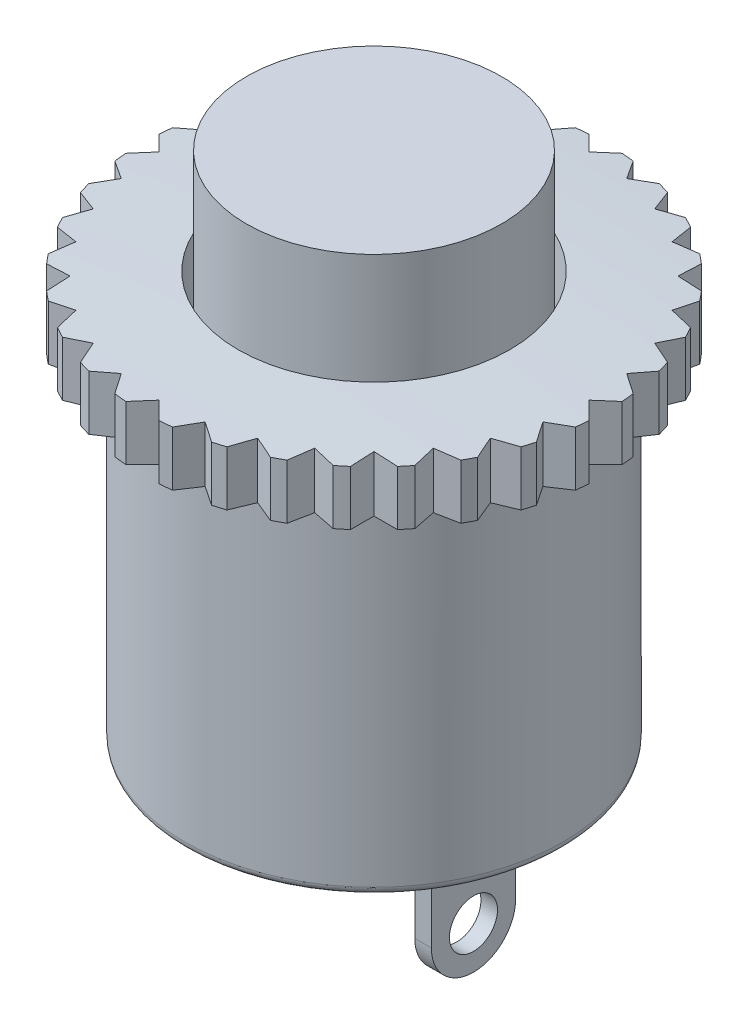
from build123d import *

# Parameters (mm, degrees)
CUT_EXTRUDE1_START  = 3
SKETCH2_R           = 4.1
SKETCH2_R_2         = 3.85
CUT_EXTRUDE1_DEPTH  = 3
CUT_EXTRUDE2_REACH  = 17.805
CIRPATTERN1_COUNT   = 32
SKETCH4_R           = 5.2
CUT_EXTRUDE3_DEPTH  = 0.5
FILLET1_R           = 0.25
SKETCH5_W           = 0.5
SKETCH5_H           = 2.54
BOSS_EXTRUDE1_DEPTH = 5
CUT_EXTRUDE4_REACH  = 25.393


with BuildPart() as part:
    # Sketch1 → Revolve1 (revolve)
    with BuildSketch(Plane.XY, mode=Mode.PRIVATE) as revolve1_sk:
        with BuildLine():
            Line((0, 0), (-3.85, 0))
            Line((-3.85, 0), (-3.85, -3.15))
            ThreePointArc((-3.85, -3.15), (-5.425674982, -3.223158245), (-7, -3.321160879))
            Line((-7, -3.321160879), (-7, -4.971160879))
            Line((-7, -4.971160879), (-5.7, -4.971160879))
            Line((-5.7, -4.971160879), (-5.7, -15.471160879))
            Line((-5.7, -15.471160879), (0, -15.471160879))
            Line((0, -15.471160879), (0, 0))
        make_face()
    revolve(revolve1_sk.sketch.rotate(Axis((0, 8.395483871, 0), (0, -1, 0)), 270), axis=Axis((0, 8.395483871, 0), (0, -1, 0)))

    # Sketch2 → Cut-Extrude1 (cut)
    with BuildSketch(Plane(origin=(0, -3.15, 0), x_dir=(-1, 0, 0), z_dir=(0, -1, 0)).offset(CUT_EXTRUDE1_START)):
        Circle(SKETCH2_R)
        with Locations(Location((0, 0, 0), (0, 0, 270))):
            Circle(SKETCH2_R_2, mode=Mode.SUBTRACT)
    extrude(amount=-CUT_EXTRUDE1_DEPTH, mode=Mode.SUBTRACT)

    # Sketch3 → Cut-Extrude2 (cut, up to next)
    with BuildSketch(Plane(origin=(0, -3.15, 0), x_dir=(-1, 0, 0), z_dir=(0, -1, 0)), mode=Mode.PRIVATE) as cut_extrude2_sk1:
        with BuildLine():
            Line((0, 6.482120022), (0, 7))
            ThreePointArc((0, 7), (-0.250159796, 6.995528577), (-0.5, 6.982120022))
            Line((-0.5, 6.982120022), (0, 6.482120022))
        make_face()
    cut_extrude2_tool1 = extrude(cut_extrude2_sk1.sketch, amount=CUT_EXTRUDE2_REACH, mode=Mode.PRIVATE) & part.part
    # Sketch3 → Cut-Extrude2 (cut, up to next)
    with BuildSketch(Plane(origin=(0, -3.15, 0), x_dir=(-1, 0, 0), z_dir=(0, -1, 0)), mode=Mode.PRIVATE) as cut_extrude2_sk2:
        with BuildLine():
            ThreePointArc((0.5, 6.982120022), (0.250159796, 6.995528577), (0, 7))
            Line((0, 7), (0, 6.482120022))
            Line((0, 6.482120022), (0.5, 6.982120022))
        make_face()
    cut_extrude2_tool2 = extrude(cut_extrude2_sk2.sketch, amount=CUT_EXTRUDE2_REACH, mode=Mode.PRIVATE) & part.part
    cut_extrude2_1 = cut_extrude2_tool1.solids().sort_by_distance((0.167616, -3.15, -6.823366))[0]
    add(cut_extrude2_1, mode=Mode.SUBTRACT)
    cut_extrude2_2 = cut_extrude2_tool2.solids().sort_by_distance((-0.167616, -3.15, -6.823366))[0]
    add(cut_extrude2_2, mode=Mode.SUBTRACT)
    cut_extrude2 = cut_extrude2_1 + cut_extrude2_2  # Cut-Extrude2 as one shape, for the pattern or mirror that repeats it

    # CirPattern1: Cut-Extrude2 ×32 about axis
    cirpattern1_axis = Axis((0, 0, 0), (0, 1, 0))
    for i in range(1, CIRPATTERN1_COUNT):
        add(cut_extrude2.rotate(cirpattern1_axis, i * 360 / CIRPATTERN1_COUNT), mode=Mode.SUBTRACT)

    # Sketch4 → Cut-Extrude3 (cut)
    with BuildSketch(Plane.XZ.offset(15.471160879)):
        with Locations(Location((0, 0, 0), (0, 0, 270))):
            Circle(SKETCH4_R)
    extrude(amount=-CUT_EXTRUDE3_DEPTH, mode=Mode.SUBTRACT)

    # Fillet1
    fillet1_edges = [part.edges().sort_by_distance(p)[0] for p in [
        (0, -15.471160879, -5.7),
    ]]
    fillet(fillet1_edges, radius=FILLET1_R)

    # Sketch5 → Boss-Extrude1 (add)
    with BuildSketch(Plane.XZ.offset(14.971160879)):
        with Locations((-2.75, 0)):
            Rectangle(SKETCH5_W, SKETCH5_H)
        with Locations((2.75, 0)):
            Rectangle(SKETCH5_W, SKETCH5_H)
    extrude(amount=BOSS_EXTRUDE1_DEPTH)

    # Cut-Extrude4: up to this face of the body (flat: up to its plane)
    cut_extrude4_end = Plane(part.part.faces().sort_by_distance((-3, -17.471160879, 0))[0])
    # Sketch6 → Cut-Extrude4 (cut, up to the picked face)
    with BuildSketch(Plane(origin=(3, 0, 0), x_dir=(0, 0, -1), z_dir=(1, 0, 0)), mode=Mode.PRIVATE) as cut_extrude4_sk1:
        with BuildLine():
            Line((-1.27, -19.971160879), (0, -19.971160879))
            ThreePointArc((0, -19.971160879), (-0.898025612, -19.599186491), (-1.27, -18.701160879))
            Line((-1.27, -18.701160879), (-1.27, -19.971160879))
        make_face()
    cut_extrude4_tool1 = split(extrude(cut_extrude4_sk1.sketch, amount=-CUT_EXTRUDE4_REACH, mode=Mode.PRIVATE), bisect_by=cut_extrude4_end, keep=Keep.BOTH, mode=Mode.PRIVATE)
    # Sketch6 → Cut-Extrude4 (cut, up to the picked face)
    with BuildSketch(Plane(origin=(3, 0, 0), x_dir=(0, 0, -1), z_dir=(1, 0, 0)), mode=Mode.PRIVATE) as cut_extrude4_sk2:
        with BuildLine():
            ThreePointArc((1.27, -18.701160879), (0.898025612, -19.599186491), (0, -19.971160879))
            Line((0, -19.971160879), (1.27, -19.971160879))
            Line((1.27, -19.971160879), (1.27, -18.701160879))
        make_face()
    cut_extrude4_tool2 = split(extrude(cut_extrude4_sk2.sketch, amount=-CUT_EXTRUDE4_REACH, mode=Mode.PRIVATE), bisect_by=cut_extrude4_end, keep=Keep.BOTH, mode=Mode.PRIVATE)
    # Sketch6 → Cut-Extrude4 (cut, up to the picked face)
    with BuildSketch(Plane(origin=(3, 0, 0), x_dir=(0, 0, -1), z_dir=(1, 0, 0)), mode=Mode.PRIVATE) as cut_extrude4_sk3:
        with BuildLine():
            ThreePointArc((0, -17.976160879), (-0.725, -18.701160879), (0, -19.426160879))
            Line((0, -19.426160879), (0, -17.976160879))
        make_face()
    cut_extrude4_tool3 = split(extrude(cut_extrude4_sk3.sketch, amount=-CUT_EXTRUDE4_REACH, mode=Mode.PRIVATE), bisect_by=cut_extrude4_end, keep=Keep.BOTH, mode=Mode.PRIVATE)
    # Sketch6 → Cut-Extrude4 (cut, up to the picked face)
    with BuildSketch(Plane(origin=(3, 0, 0), x_dir=(0, 0, -1), z_dir=(1, 0, 0)), mode=Mode.PRIVATE) as cut_extrude4_sk4:
        with BuildLine():
            Line((0, -17.976160879), (0, -19.426160879))
            ThreePointArc((0, -19.426160879), (0.512652416, -19.213813295), (0.725, -18.701160879))
            ThreePointArc((0.725, -18.701160879), (0.512652416, -18.188508463), (0, -17.976160879))
        make_face()
    cut_extrude4_tool4 = split(extrude(cut_extrude4_sk4.sketch, amount=-CUT_EXTRUDE4_REACH, mode=Mode.PRIVATE), bisect_by=cut_extrude4_end, keep=Keep.BOTH, mode=Mode.PRIVATE)
    # Sketch6 → Cut-Extrude4 (cut, up to the picked face)
    with BuildSketch(Plane(origin=(3, 0, 0), x_dir=(0, 0, -1), z_dir=(1, 0, 0)), mode=Mode.PRIVATE) as cut_extrude4_sk5:
        with BuildLine():
            ThreePointArc((0, -17.976160879), (-0.725, -18.701160879), (0, -19.426160879))
            Line((0, -19.426160879), (0, -17.976160879))
        make_face()
    cut_extrude4_tool5 = split(extrude(cut_extrude4_sk5.sketch, amount=-CUT_EXTRUDE4_REACH, mode=Mode.PRIVATE), bisect_by=cut_extrude4_end, keep=Keep.BOTH, mode=Mode.PRIVATE)
    # Sketch6 → Cut-Extrude4 (cut, up to the picked face)
    with BuildSketch(Plane(origin=(3, 0, 0), x_dir=(0, 0, -1), z_dir=(1, 0, 0)), mode=Mode.PRIVATE) as cut_extrude4_sk6:
        with BuildLine():
            Line((0, -17.976160879), (0, -19.426160879))
            ThreePointArc((0, -19.426160879), (0.512652416, -19.213813295), (0.725, -18.701160879))
            ThreePointArc((0.725, -18.701160879), (0.512652416, -18.188508463), (0, -17.976160879))
        make_face()
    cut_extrude4_tool6 = split(extrude(cut_extrude4_sk6.sketch, amount=-CUT_EXTRUDE4_REACH, mode=Mode.PRIVATE), bisect_by=cut_extrude4_end, keep=Keep.BOTH, mode=Mode.PRIVATE)
    add(cut_extrude4_tool1.solids().sort_by(Axis((3, -19.687484, 0.986323), (-1, 0, 0)))[0], mode=Mode.SUBTRACT)
    add(cut_extrude4_tool2.solids().sort_by(Axis((3, -19.687484, -0.986323), (-1, 0, 0)))[0], mode=Mode.SUBTRACT)
    add(cut_extrude4_tool3.solids().sort_by(Axis((3, -18.701161, 0.3077), (-1, 0, 0)))[0], mode=Mode.SUBTRACT)
    add(cut_extrude4_tool4.solids().sort_by(Axis((3, -18.701161, -0.3077), (-1, 0, 0)))[0], mode=Mode.SUBTRACT)
    add(cut_extrude4_tool5.solids().sort_by(Axis((3, -18.701161, 0.3077), (-1, 0, 0)))[0], mode=Mode.SUBTRACT)
    add(cut_extrude4_tool6.solids().sort_by(Axis((3, -18.701161, -0.3077), (-1, 0, 0)))[0], mode=Mode.SUBTRACT)


solid = part.part
